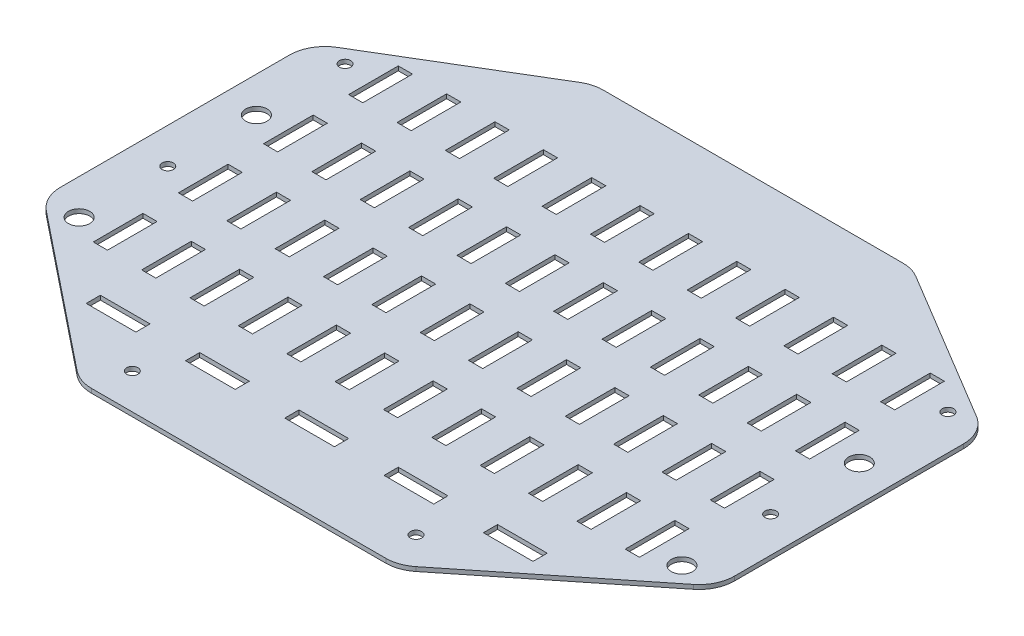
from build123d import *

# Parameters (mm, degrees)
SKETCH_1_R          = 1.6
SKETCH_1_R_2        = 3
EXTRUDE_1_DEPTH     = 1.2
SKETCH_2_W          = 4
SKETCH_2_H          = 14
SKETCH_2_W_2        = 14
SKETCH_2_H_2        = 4
CUT_EXTRUDE_1_DEPTH = 240.011380482
FILLET_1_R          = 10


with BuildPart() as part:
    # 草图1 → 凸台-拉伸1 (new body)
    with BuildSketch(Plane(origin=(0, 0, 0), x_dir=(1, 0, 0), z_dir=(0, 1, 0))):
        Polygon((0, 40), (50, 0), (140, 0), (190, 40), (190, 115), (140, 145), (50, 145), (0, 115), align=None)
        with Locations(Location((55, 10, 0), (0, 0, 270))):
            Circle(SKETCH_1_R, mode=Mode.SUBTRACT)
        with Locations(Location((10, 40, 0), (0, 0, 270))):
            Circle(SKETCH_1_R_2, mode=Mode.SUBTRACT)
        with Locations(Location((10, 65, 0), (0, 0, 270))):
            Circle(SKETCH_1_R, mode=Mode.SUBTRACT)
        with Locations(Location((135, 10, 0), (0, 0, 270))):
            Circle(SKETCH_1_R, mode=Mode.SUBTRACT)
        with Locations(Location((180, 40, 0), (0, 0, 270))):
            Circle(SKETCH_1_R_2, mode=Mode.SUBTRACT)
        with Locations(Location((180, 65, 0), (0, 0, 270))):
            Circle(SKETCH_1_R, mode=Mode.SUBTRACT)
        with Locations(Location((10, 90, 0), (0, 0, 270))):
            Circle(SKETCH_1_R_2, mode=Mode.SUBTRACT)
        with Locations(Location((10, 115, 0), (0, 0, 270))):
            Circle(SKETCH_1_R, mode=Mode.SUBTRACT)
        with Locations(Location((180, 90, 0), (0, 0, 270))):
            Circle(SKETCH_1_R_2, mode=Mode.SUBTRACT)
        with Locations(Location((180, 115, 0), (0, 0, 270))):
            Circle(SKETCH_1_R, mode=Mode.SUBTRACT)
    extrude(amount=EXTRUDE_1_DEPTH)

    # 草图2 → 切除-拉伸1 (cut, through all)
    with BuildSketch(Plane(origin=(0, 1.2, 0), x_dir=(1, 0, 0), z_dir=(0, 1, 0))):
        with Locations((20, 115)):
            Rectangle(SKETCH_2_W, SKETCH_2_H)
        with Locations((33.636363636, 115)):
            Rectangle(SKETCH_2_W, SKETCH_2_H)
        with Locations((47.272727273, 115)):
            Rectangle(SKETCH_2_W, SKETCH_2_H)
        with Locations((60.909090909, 115)):
            Rectangle(SKETCH_2_W, SKETCH_2_H)
        with Locations((74.545454545, 115)):
            Rectangle(SKETCH_2_W, SKETCH_2_H)
        with Locations((88.181818182, 115)):
            Rectangle(SKETCH_2_W, SKETCH_2_H)
        with Locations((101.818181818, 115)):
            Rectangle(SKETCH_2_W, SKETCH_2_H)
        with Locations((115.454545455, 115)):
            Rectangle(SKETCH_2_W, SKETCH_2_H)
        with Locations((129.090909091, 115)):
            Rectangle(SKETCH_2_W, SKETCH_2_H)
        with Locations((142.727272727, 115)):
            Rectangle(SKETCH_2_W, SKETCH_2_H)
        with Locations((156.363636364, 115)):
            Rectangle(SKETCH_2_W, SKETCH_2_H)
        with Locations((170, 115)):
            Rectangle(SKETCH_2_W, SKETCH_2_H)
        with Locations((33.636363636, 91)):
            Rectangle(SKETCH_2_W, SKETCH_2_H)
        with Locations((47.272727273, 91)):
            Rectangle(SKETCH_2_W, SKETCH_2_H)
        with Locations((60.909090909, 91)):
            Rectangle(SKETCH_2_W, SKETCH_2_H)
        with Locations((74.545454545, 91)):
            Rectangle(SKETCH_2_W, SKETCH_2_H)
        with Locations((88.181818182, 91)):
            Rectangle(SKETCH_2_W, SKETCH_2_H)
        with Locations((101.818181818, 91)):
            Rectangle(SKETCH_2_W, SKETCH_2_H)
        with Locations((115.454545455, 91)):
            Rectangle(SKETCH_2_W, SKETCH_2_H)
        with Locations((129.090909091, 91)):
            Rectangle(SKETCH_2_W, SKETCH_2_H)
        with Locations((142.727272727, 91)):
            Rectangle(SKETCH_2_W, SKETCH_2_H)
        with Locations((156.363636364, 91)):
            Rectangle(SKETCH_2_W, SKETCH_2_H)
        with Locations((170, 91)):
            Rectangle(SKETCH_2_W, SKETCH_2_H)
        with Locations((33.636363636, 67)):
            Rectangle(SKETCH_2_W, SKETCH_2_H)
        with Locations((47.272727273, 67)):
            Rectangle(SKETCH_2_W, SKETCH_2_H)
        with Locations((60.909090909, 67)):
            Rectangle(SKETCH_2_W, SKETCH_2_H)
        with Locations((74.545454545, 67)):
            Rectangle(SKETCH_2_W, SKETCH_2_H)
        with Locations((88.181818182, 67)):
            Rectangle(SKETCH_2_W, SKETCH_2_H)
        with Locations((101.818181818, 67)):
            Rectangle(SKETCH_2_W, SKETCH_2_H)
        with Locations((115.454545455, 67)):
            Rectangle(SKETCH_2_W, SKETCH_2_H)
        with Locations((129.090909091, 67)):
            Rectangle(SKETCH_2_W, SKETCH_2_H)
        with Locations((142.727272727, 67)):
            Rectangle(SKETCH_2_W, SKETCH_2_H)
        with Locations((156.363636364, 67)):
            Rectangle(SKETCH_2_W, SKETCH_2_H)
        with Locations((170, 67)):
            Rectangle(SKETCH_2_W, SKETCH_2_H)
        with Locations((33.636363636, 43)):
            Rectangle(SKETCH_2_W, SKETCH_2_H)
        with Locations((47.272727273, 43)):
            Rectangle(SKETCH_2_W, SKETCH_2_H)
        with Locations((60.909090909, 43)):
            Rectangle(SKETCH_2_W, SKETCH_2_H)
        with Locations((74.545454545, 43)):
            Rectangle(SKETCH_2_W, SKETCH_2_H)
        with Locations((88.181818182, 43)):
            Rectangle(SKETCH_2_W, SKETCH_2_H)
        with Locations((101.818181818, 43)):
            Rectangle(SKETCH_2_W, SKETCH_2_H)
        with Locations((115.454545455, 43)):
            Rectangle(SKETCH_2_W, SKETCH_2_H)
        with Locations((129.090909091, 43)):
            Rectangle(SKETCH_2_W, SKETCH_2_H)
        with Locations((142.727272727, 43)):
            Rectangle(SKETCH_2_W, SKETCH_2_H)
        with Locations((156.363636364, 43)):
            Rectangle(SKETCH_2_W, SKETCH_2_H)
        with Locations((170, 43)):
            Rectangle(SKETCH_2_W, SKETCH_2_H)
        with Locations((20, 91)):
            Rectangle(SKETCH_2_W, SKETCH_2_H)
        with Locations((20, 67)):
            Rectangle(SKETCH_2_W, SKETCH_2_H)
        with Locations((20, 43)):
            Rectangle(SKETCH_2_W, SKETCH_2_H)
        with Locations((67, 22)):
            Rectangle(SKETCH_2_W_2, SKETCH_2_H_2)
        with Locations((39, 22)):
            Rectangle(SKETCH_2_W_2, SKETCH_2_H_2)
        with Locations((95, 22)):
            Rectangle(SKETCH_2_W_2, SKETCH_2_H_2)
        with Locations((123, 22)):
            Rectangle(SKETCH_2_W_2, SKETCH_2_H_2)
        with Locations((151, 22)):
            Rectangle(SKETCH_2_W_2, SKETCH_2_H_2)
    extrude(amount=-CUT_EXTRUDE_1_DEPTH, mode=Mode.SUBTRACT)

    # 圆角1
    fillet_1_edges = [part.edges().sort_by_distance(p)[0] for p in [
        (140, 0.6, 0),
        (50, 0.6, 0),
        (0, 0.6, -40),
        (0, 0.6, -115),
        (50, 0.6, -145),
        (140, 0.6, -145),
        (190, 0.6, -115),
        (190, 0.6, -40),
    ]]
    fillet(fillet_1_edges, radius=FILLET_1_R)


solid = part.part
